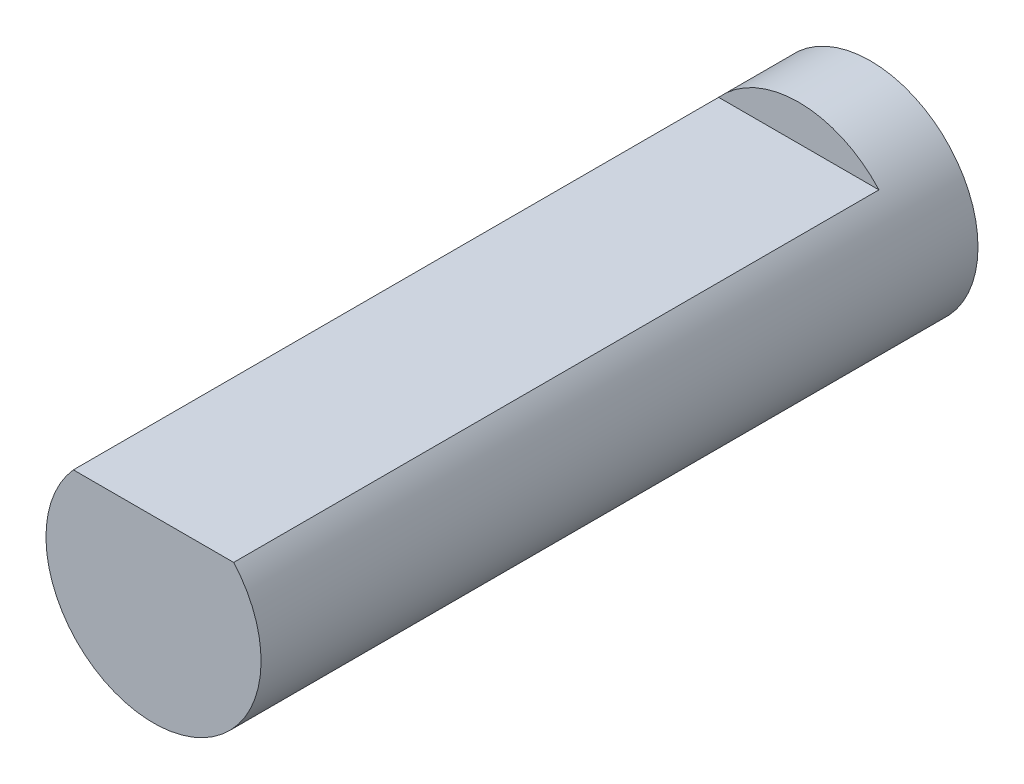
from build123d import *

# Parameters (mm, degrees)
SKETCH1_R           = 1.5
BOSS_EXTRUDE1_DEPTH = 10
CUT_EXTRUDE1_START  = -9
CUT_EXTRUDE1_DEPTH  = 9


with BuildPart() as part:
    # Sketch1 → Boss-Extrude1 (new body)
    with BuildSketch(Plane.XY):
        Circle(SKETCH1_R)
    extrude(amount=BOSS_EXTRUDE1_DEPTH)

    # Sketch2 → Cut-Extrude1 (cut)
    with BuildSketch(Plane.XY.offset(10).offset(CUT_EXTRUDE1_START)):
        with BuildLine():
            Line((-1.118033989, 1), (1.118033989, 1))
            ThreePointArc((1.118033989, 1), (0, 1.5), (-1.118033989, 1))
        make_face()
    extrude(amount=CUT_EXTRUDE1_DEPTH, mode=Mode.SUBTRACT)


solid = part.part
